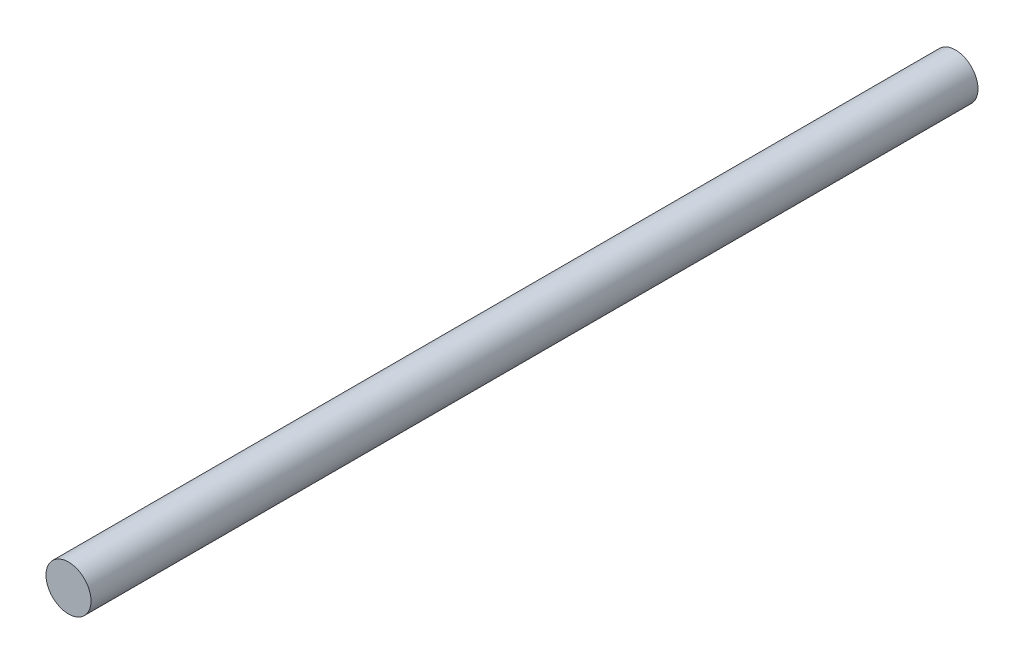
from build123d import *

# Parameters (mm, degrees)
SKETCH1_R           = 1.984375
BOSS_EXTRUDE1_DEPTH = 78.12532


with BuildPart() as part:
    # Sketch1 → Boss-Extrude1 (new body)
    with BuildSketch(Plane.XY):
        Circle(SKETCH1_R)
    extrude(amount=BOSS_EXTRUDE1_DEPTH)


solid = part.part
